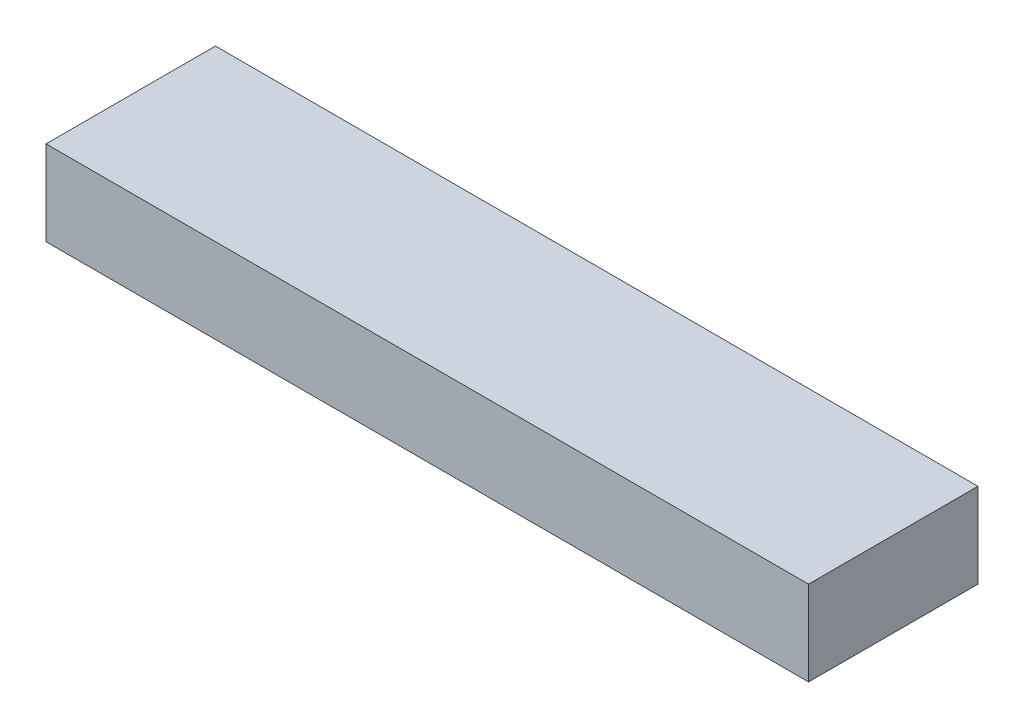
from build123d import *

# Parameters (mm, degrees)
SKETCH3_W           = 450
SKETCH3_H           = 100
BOSS_EXTRUDE1_DEPTH = 50


with BuildPart() as part:
    # Sketch3 → Boss-Extrude1 (new body)
    with BuildSketch(Plane(origin=(0, 0, 0), x_dir=(1, 0, 0), z_dir=(0, 1, 0))):
        Rectangle(SKETCH3_W, SKETCH3_H)
    extrude(amount=BOSS_EXTRUDE1_DEPTH)


solid = part.part
